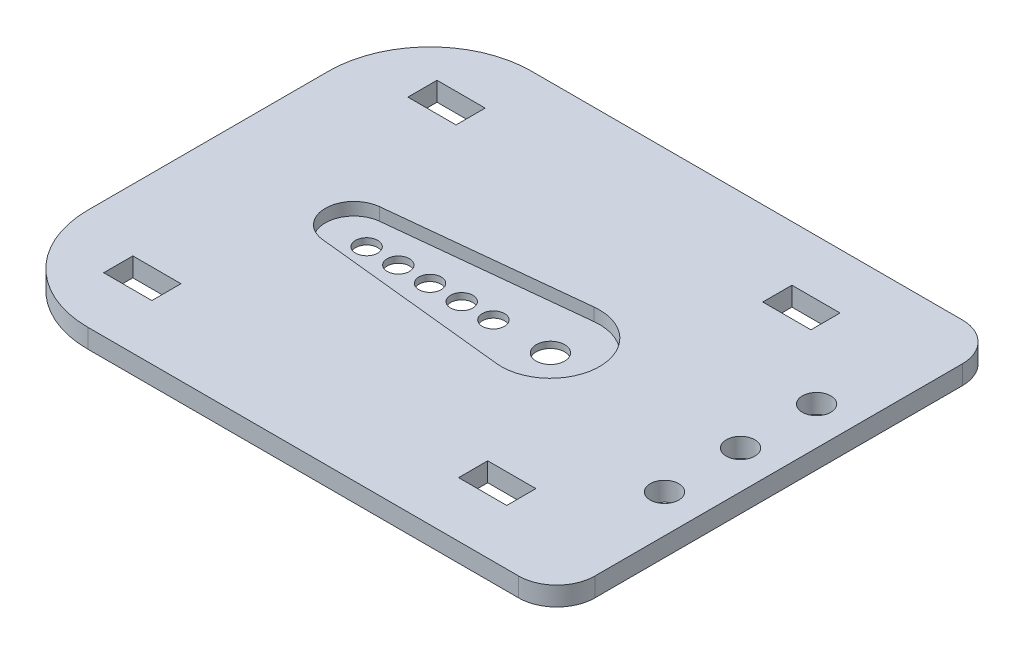
from build123d import *

# Parameters (mm, degrees)
SALIENTE_EXTRUIR1_DEPTH = 1.5
CORTAR_EXTRUIR1_DEPTH   = 1
CROQUIS3_R              = 1.125
CROQUIS3_W              = 3.8
CROQUIS3_H              = 2.3
CORTAR_EXTRUIR2_DEPTH   = 1
CROQUIS4_R              = 0.875
CORTAR_EXTRUIR3_DEPTH   = 10


with BuildPart() as part:
    # Croquis1 → Saliente-Extruir1 (new body)
    with BuildSketch(Plane(origin=(0, 0, 0), x_dir=(1, 0, 0), z_dir=(0, 1, 0))):
        with BuildLine():
            Line((-14.5, -17.5), (19.5, -17.5))
            ThreePointArc((19.5, -17.5), (21.621320344, -16.621320344), (22.5, -14.5))
            Line((22.5, -14.5), (22.5, 14.5))
            ThreePointArc((22.5, 14.5), (21.621320344, 16.621320344), (19.5, 17.5))
            Line((19.5, 17.5), (-14.5, 17.5))
            ThreePointArc((-14.5, 17.5), (-20.156854249, 15.156854249), (-22.5, 9.5))
            Line((-22.5, 9.5), (-22.5, -9.5))
            ThreePointArc((-22.5, -9.5), (-20.156854249, -15.156854249), (-14.5, -17.5))
        make_face()
    extrude(amount=SALIENTE_EXTRUIR1_DEPTH)

    # Croquis2 → Cortar-Extruir1 (cut)
    with BuildSketch(Plane(origin=(0, 1.5, 0), x_dir=(1, 0, 0), z_dir=(0, 1, 0))):
        with BuildLine():
            Line((-11.235477419, 2.247698909), (4.09625, 3.853908527))
            ThreePointArc((4.09625, 3.853908527), (8.375, 0), (4.09625, -3.853908527))
            Line((4.09625, -3.853908527), (-11.235477419, -2.247698909))
            ThreePointArc((-11.235477419, -2.247698909), (-13.26, 0), (-11.235477419, 2.247698909))
        make_face()
    extrude(amount=-CORTAR_EXTRUIR1_DEPTH, mode=Mode.SUBTRACT)

    # Croquis3 → Cortar-Extruir2 (cut, symmetric)
    with BuildSketch(Plane(origin=(0, 0.5, 0), x_dir=(1, 0, 0), z_dir=(0, 1, 0))):
        with Locations(Location((4.5, 0, 0), (0, 0, 270))):
            Circle(CROQUIS3_R)
        with Locations(Location((19.5, 6, 0), (0, 0, 270))):
            Circle(CROQUIS3_R)
        with Locations(Location((19.5, -6, 0), (0, 0, 270))):
            Circle(CROQUIS3_R)
        with Locations(Location((19.5, 0, 0), (0, 0, 270))):
            Circle(CROQUIS3_R)
        with Locations((-15.697233885, -12)):
            Rectangle(CROQUIS3_W, CROQUIS3_H)
        with Locations((12.302766115, -12)):
            Rectangle(CROQUIS3_W, CROQUIS3_H)
        with Locations((12.302766115, 12)):
            Rectangle(CROQUIS3_W, CROQUIS3_H)
        with Locations((-15.697233885, 12)):
            Rectangle(CROQUIS3_W, CROQUIS3_H)
    extrude(amount=CORTAR_EXTRUIR2_DEPTH, both=True, mode=Mode.SUBTRACT)

    # Croquis4 → Cortar-Extruir3 (cut)
    with BuildSketch(Plane(origin=(0, 1.5, 0), x_dir=(1, 0, 0), z_dir=(0, 1, 0))):
        with Locations(Location((0, 0, 0), (0, 0, 270))):
            Circle(CROQUIS4_R)
        with Locations(Location((-5, 0, 0), (0, 0, 270))):
            Circle(CROQUIS4_R)
        with Locations(Location((-2.5, 0, 0), (0, 0, 270))):
            Circle(CROQUIS4_R)
        with Locations(Location((-7.5, 0, 0), (0, 0, 270))):
            Circle(CROQUIS4_R)
        with Locations(Location((-10, 0, 0), (0, 0, 270))):
            Circle(CROQUIS4_R)
    extrude(amount=-CORTAR_EXTRUIR3_DEPTH, mode=Mode.SUBTRACT)


solid = part.part
